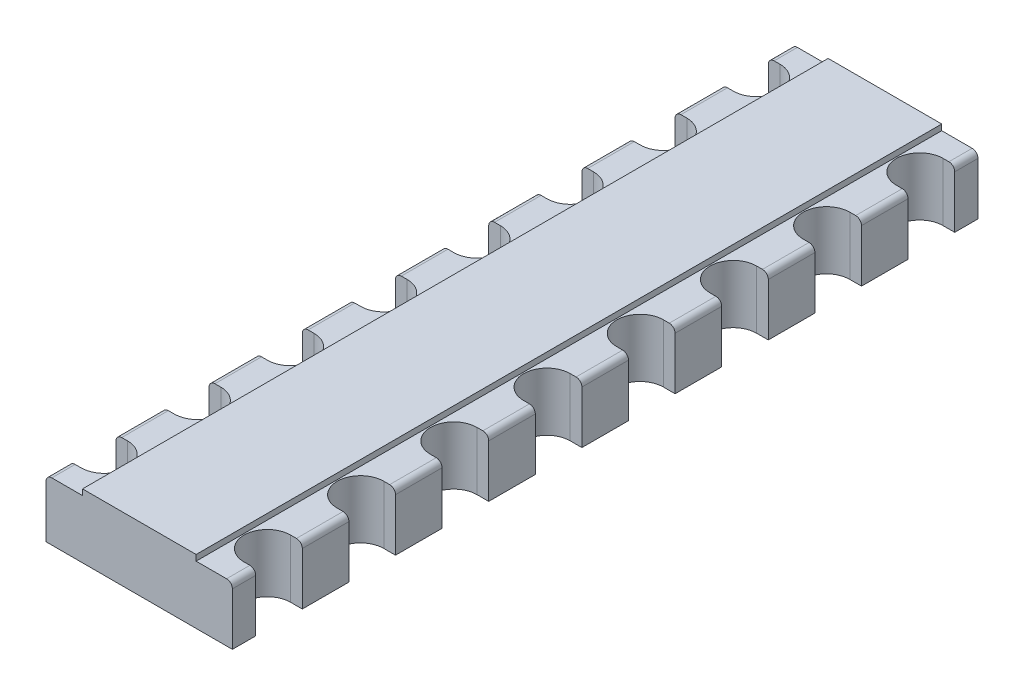
from build123d import *

# Parameters (mm, degrees)
BOSS_EXTRUDE1_DEPTH = 0.5
SKETCH2_W           = 0.974965632
SKETCH2_H           = 6.4
BOSS_EXTRUDE2_DEPTH = 0.05
FILLET2_R           = 0.05


with BuildPart() as part:
    # Sketch1 → Boss-Extrude1 (new body)
    with BuildSketch(Plane(origin=(0, 0, 0), x_dir=(1, 0, 0), z_dir=(0, 1, 0))):
        with BuildLine():
            Line((-0.8, 3.2), (-0.8, 3))
            Line((-0.8, 3), (-0.7, 3))
            ThreePointArc((-0.7, 3), (-0.5, 2.8), (-0.7, 2.6))
            Line((-0.7, 2.6), (-0.8, 2.6))
            Line((-0.8, 2.6), (-0.8, 2.2))
            Line((-0.8, 2.2), (-0.7, 2.2))
            ThreePointArc((-0.7, 2.2), (-0.5, 2), (-0.7, 1.8))
            Line((-0.7, 1.8), (-0.8, 1.8))
            Line((-0.8, 1.8), (-0.8, 1.4))
            Line((-0.8, 1.4), (-0.7, 1.4))
            ThreePointArc((-0.7, 1.4), (-0.5, 1.2), (-0.7, 1))
            Line((-0.7, 1), (-0.8, 1))
            Line((-0.8, 1), (-0.8, 0.6))
            Line((-0.8, 0.6), (-0.7, 0.6))
            ThreePointArc((-0.7, 0.6), (-0.5, 0.4), (-0.7, 0.2))
            Line((-0.7, 0.2), (-0.8, 0.2))
            Line((-0.8, 0.2), (-0.8, -0.2))
            Line((-0.8, -0.2), (-0.7, -0.2))
            ThreePointArc((-0.7, -0.2), (-0.5, -0.4), (-0.7, -0.6))
            Line((-0.7, -0.6), (-0.8, -0.6))
            Line((-0.8, -0.6), (-0.8, -1))
            Line((-0.8, -1), (-0.7, -1))
            ThreePointArc((-0.7, -1), (-0.5, -1.2), (-0.7, -1.4))
            Line((-0.7, -1.4), (-0.8, -1.4))
            Line((-0.8, -1.4), (-0.8, -1.8))
            Line((-0.8, -1.8), (-0.7, -1.8))
            ThreePointArc((-0.7, -1.8), (-0.5, -2), (-0.7, -2.2))
            Line((-0.7, -2.2), (-0.8, -2.2))
            Line((-0.8, -2.2), (-0.8, -2.6))
            Line((-0.8, -2.6), (-0.7, -2.6))
            ThreePointArc((-0.7, -2.6), (-0.5, -2.8), (-0.7, -3))
            Line((-0.7, -3), (-0.8, -3))
            Line((-0.8, -3), (-0.8, -3.2))
            Line((-0.8, -3.2), (0.8, -3.2))
            Line((0.8, -3.2), (0.8, -3))
            Line((0.8, -3), (0.7, -3))
            ThreePointArc((0.7, -3), (0.5, -2.8), (0.7, -2.6))
            Line((0.7, -2.6), (0.8, -2.6))
            Line((0.8, -2.6), (0.8, -2.2))
            Line((0.8, -2.2), (0.7, -2.2))
            ThreePointArc((0.7, -2.2), (0.5, -2), (0.7, -1.8))
            Line((0.7, -1.8), (0.8, -1.8))
            Line((0.8, -1.8), (0.8, -1.4))
            Line((0.8, -1.4), (0.7, -1.4))
            ThreePointArc((0.7, -1.4), (0.5, -1.2), (0.7, -1))
            Line((0.7, -1), (0.8, -1))
            Line((0.8, -1), (0.8, -0.6))
            Line((0.8, -0.6), (0.7, -0.6))
            ThreePointArc((0.7, -0.6), (0.5, -0.4), (0.7, -0.2))
            Line((0.7, -0.2), (0.8, -0.2))
            Line((0.8, -0.2), (0.8, 0.2))
            Line((0.8, 0.2), (0.7, 0.2))
            ThreePointArc((0.7, 0.2), (0.5, 0.4), (0.7, 0.6))
            Line((0.7, 0.6), (0.8, 0.6))
            Line((0.8, 0.6), (0.8, 1))
            Line((0.8, 1), (0.7, 1))
            ThreePointArc((0.7, 1), (0.5, 1.2), (0.7, 1.4))
            Line((0.7, 1.4), (0.8, 1.4))
            Line((0.8, 1.4), (0.8, 1.8))
            Line((0.8, 1.8), (0.7, 1.8))
            ThreePointArc((0.7, 1.8), (0.5, 2), (0.7, 2.2))
            Line((0.7, 2.2), (0.8, 2.2))
            Line((0.8, 2.2), (0.8, 2.6))
            Line((0.8, 2.6), (0.7, 2.6))
            ThreePointArc((0.7, 2.6), (0.5, 2.8), (0.7, 3))
            Line((0.7, 3), (0.8, 3))
            Line((0.8, 3), (0.8, 3.2))
            Line((0.8, 3.2), (-0.8, 3.2))
        make_face()
    extrude(amount=BOSS_EXTRUDE1_DEPTH)

    # Sketch2 → Boss-Extrude2 (add)
    with BuildSketch(Plane(origin=(0, 0.5, 0), x_dir=(1, 0, 0), z_dir=(0, 1, 0))):
        with Locations((0.001088626, 0)):
            Rectangle(SKETCH2_W, SKETCH2_H)
    extrude(amount=BOSS_EXTRUDE2_DEPTH)

    # Fillet2
    fillet2_edges = [part.edges().sort_by_distance(p)[0] for p in [
        (-0.8, 0.5, 1.6),
        (-0.8, 0.5, 2.4),
        (-0.8, 0.5, 3.1),
        (0.8, 0.5, 3.1),
        (0.8, 0.5, 2.4),
        (0.8, 0.5, 1.6),
        (0.8, 0.5, 0.8),
        (0.8, 0.5, 0),
        (0.8, 0.5, -0.8),
        (0.8, 0.5, -1.6),
        (-0.8, 0.5, -2.4),
        (0.8, 0.5, -2.4),
        (0.8, 0.5, -3.1),
        (-0.8, 0.5, -1.6),
        (-0.8, 0.5, -0.8),
        (-0.8, 0.5, 0),
        (-0.8, 0.5, 0.8),
        (-0.8, 0.5, -3.1),
    ]]
    fillet(fillet2_edges, radius=FILLET2_R)


solid = part.part
